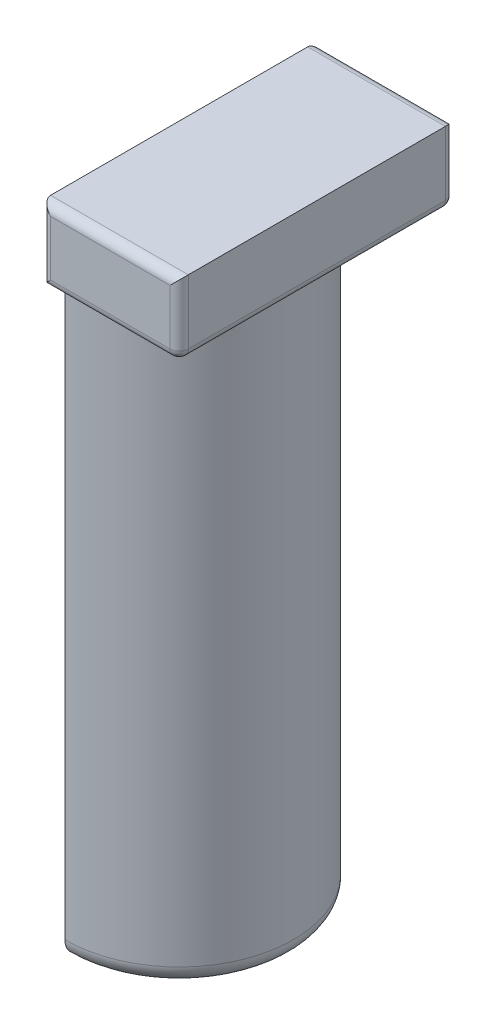
from build123d import *

# Parameters (mm, degrees)
SKETCH_1_W          = 30
SKETCH_1_H          = 30
EXTRUDE_1_DEPTH     = 8
SKETCH_2_R          = 12.45
EXTRUDE_2_DEPTH     = 65
SKETCH_3_W          = 15
SKETCH_3_H          = 30
CUT_EXTRUDE_1_DEPTH = 85.433405711
FILLET_1_R          = 2
FILLET_2_R          = 1


with BuildPart() as part:
    # 草图1 → 凸台-拉伸1 (new body)
    with BuildSketch(Plane(origin=(0, 0, 0), x_dir=(1, 0, 0), z_dir=(0, 1, 0))):
        with Locations((-15, 15)):
            Rectangle(SKETCH_1_W, SKETCH_1_H)
    extrude(amount=EXTRUDE_1_DEPTH)

    # 草图2 → 凸台-拉伸2 (add)
    with BuildSketch(Plane.XZ):
        with Locations(Location((-15, -15, 0), (0, 0, 270))):
            Circle(SKETCH_2_R)
    extrude(amount=EXTRUDE_2_DEPTH)

    # 草图3 → 切除-拉伸1 (cut, through all)
    with BuildSketch(Plane(origin=(0, 8, 0), x_dir=(1, 0, 0), z_dir=(0, 1, 0))):
        with Locations((-22.5, 15)):
            Rectangle(SKETCH_3_W, SKETCH_3_H)
    extrude(amount=-CUT_EXTRUDE_1_DEPTH, mode=Mode.SUBTRACT)

    # 圆角1
    fillet_1_edges = [part.edges().sort_by_distance(p)[0] for p in [
        (-2.55, -65, -15),
    ]]
    fillet(fillet_1_edges, radius=FILLET_1_R)

    # 圆角2
    fillet_2_edges = [part.edges().sort_by_distance(p)[0] for p in [
        (-7.5, 0, 0),
        (-7.5, 8, 0),
        (-15, 4, 0),
        (-15, 4, -30),
        (-7.5, 0, -30),
        (0, 0, -15),
        (0, 4, 0),
        (0, 4, -30),
        (-7.5, 8, -30),
    ]]
    fillet(fillet_2_edges, radius=FILLET_2_R)


solid = part.part
